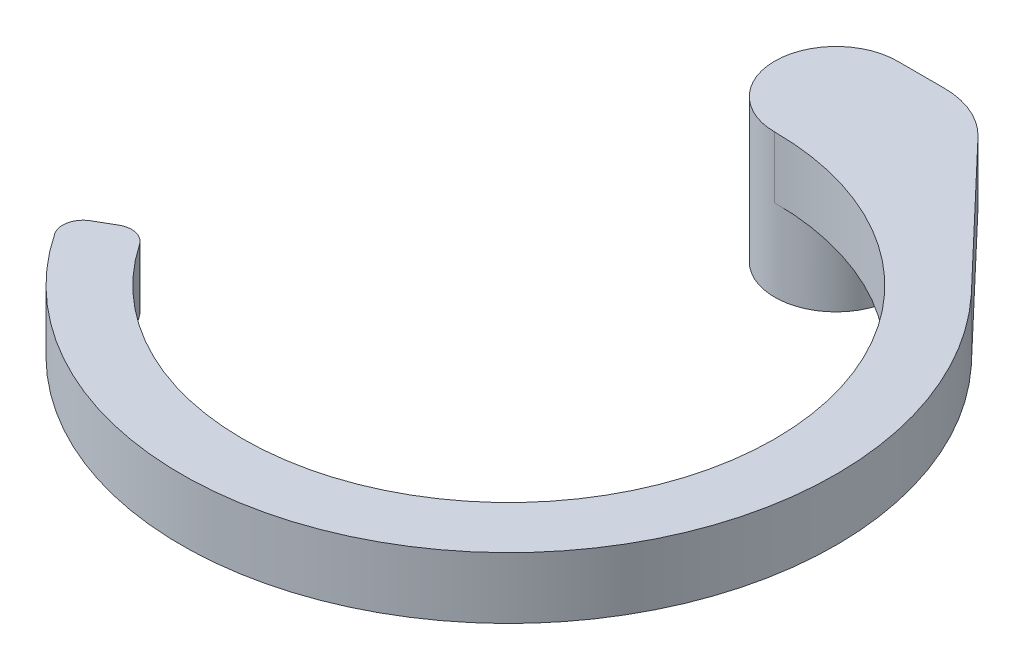
from build123d import *

# Parameters (mm, degrees)
EXTRUDE_4_DEPTH     = 15
EXTRUDE_START       = 20
SKETCH_4_R          = 15
EXTRUDE_5_DEPTH     = 20
SKETCH_5_R          = 10.1
CUT_EXTRUDE_1_DEPTH = 2


with BuildPart() as part:
    # ｽｹｯﾁ2 → ﾎﾞｽ - 押し出し4 (new body)
    with BuildSketch(Plane(origin=(0, 0, 0), x_dir=(1, 0, 0), z_dir=(0, 1, 0))):
        with BuildLine():
            ThreePointArc((-53.82643789, -36.437818048), (-56.846261527, -34.367935813), (-60.466933112, -34.910600109))
            Line((-60.466933112, -34.910600109), (-64.807406984, -37.416573868))
            ThreePointArc((-64.807406984, -37.416573868), (-67.177509772, -40.614402853), (-66.461234116, -44.529814279))
            ThreePointArc((-66.461234116, -44.529814279), (49.665387485, -62.716419588), (58.57572973, 54.487465409))
            Line((58.57572973, 54.487465409), (57.289371136, 55.838409315))
            Line((57.289371136, 55.838409315), (25.911523347, 88.791671712))
            ThreePointArc((25.911523347, 88.791671712), (19.306695871, 93.382511176), (11.427401304, 95))
            Line((11.427401304, 95), (0, 95))
            ThreePointArc((0, 95), (-15, 80), (0, 65))
            ThreePointArc((0, 65), (57.41714976, -30.467538684), (-53.82643789, -36.437818048))
        make_face()
    extrude(amount=EXTRUDE_4_DEPTH)

    # ｽｹｯﾁ4 → ﾎﾞｽ - 押し出し5 (add)
    with BuildSketch(Plane.XZ.offset(EXTRUDE_START)):
        with Locations(Location((0, -80, 0), (0, 0, 270))):
            Circle(SKETCH_4_R)
    extrude(amount=-EXTRUDE_5_DEPTH)

    # ｽｹｯﾁ5 → ｶｯﾄ - 押し出し1 (cut)
    with BuildSketch(Plane(origin=(0, -20, 0), x_dir=(-1, 0, 0), z_dir=(0, -1, 0))):
        with Locations(Location((0, 80, 0), (0, 0, 90))):
            Circle(SKETCH_5_R)
    extrude(amount=-CUT_EXTRUDE_1_DEPTH, mode=Mode.SUBTRACT)


solid = part.part
